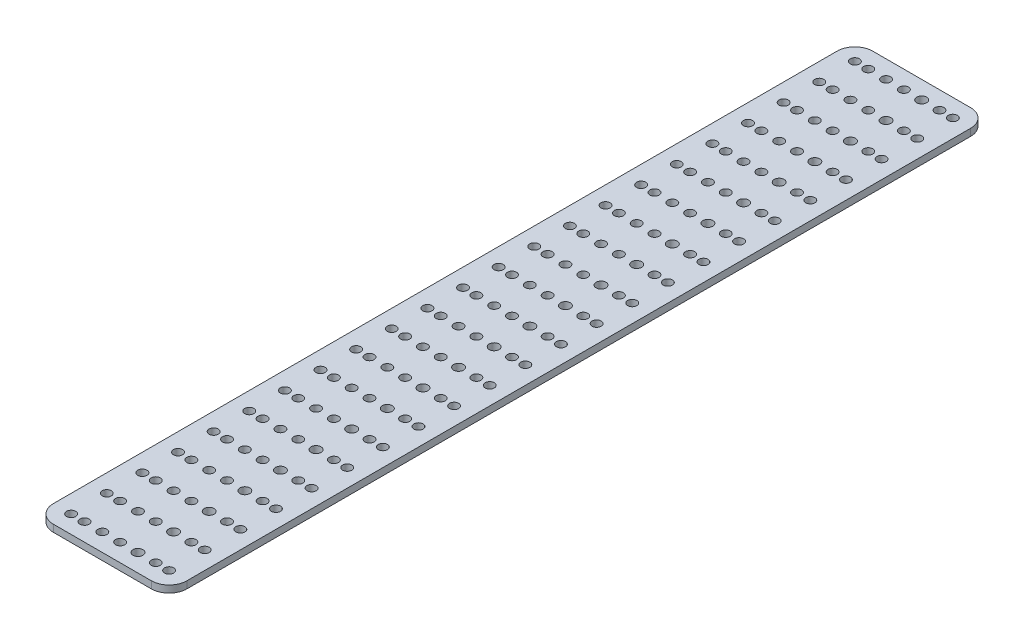
from build123d import *

# Parameters (mm, degrees)
SKETCH2_W           = 60
SKETCH2_H           = 368
SKETCH2_R           = 2.05
SKETCH2_R_2         = 2.218759553
BOSS_EXTRUDE2_DEPTH = 3.175
FILLET1_R           = 8


with BuildPart() as part:
    # Sketch2 → Boss-Extrude2 (new body)
    with BuildSketch(Plane(origin=(0, 0, 0), x_dir=(1, 0, 0), z_dir=(0, 1, 0))):
        Rectangle(SKETCH2_W, SKETCH2_H)
        with Locations(Location((-22, 176, 0), (0, 0, 270))):
            Circle(SKETCH2_R, mode=Mode.SUBTRACT)
        with Locations(Location((-16, 176, 0), (0, 0, 270))):
            Circle(SKETCH2_R, mode=Mode.SUBTRACT)
        with Locations(Location((0, 176, 0), (0, 0, 270))):
            Circle(SKETCH2_R, mode=Mode.SUBTRACT)
        with Locations(Location((16, 176, 0), (0, 0, 270))):
            Circle(SKETCH2_R, mode=Mode.SUBTRACT)
        with Locations(Location((22, 176, 0), (0, 0, 90))):
            Circle(SKETCH2_R, mode=Mode.SUBTRACT)
        with Locations(Location((-8, 176, 0), (0, 0, 270))):
            Circle(SKETCH2_R, mode=Mode.SUBTRACT)
        with Locations(Location((8, 176, 0), (0, 0, 270))):
            Circle(SKETCH2_R_2, mode=Mode.SUBTRACT)
        with Locations(Location((22, 160, 0), (0, 0, 90))):
            Circle(SKETCH2_R, mode=Mode.SUBTRACT)
        with Locations(Location((16, 160, 0), (0, 0, 270))):
            Circle(SKETCH2_R, mode=Mode.SUBTRACT)
        with Locations(Location((8, 160, 0), (0, 0, 270))):
            Circle(SKETCH2_R_2, mode=Mode.SUBTRACT)
        with Locations(Location((0, 160, 0), (0, 0, 270))):
            Circle(SKETCH2_R, mode=Mode.SUBTRACT)
        with Locations(Location((-8, 160, 0), (0, 0, 270))):
            Circle(SKETCH2_R, mode=Mode.SUBTRACT)
        with Locations(Location((-16, 160, 0), (0, 0, 270))):
            Circle(SKETCH2_R, mode=Mode.SUBTRACT)
        with Locations(Location((-22, 160, 0), (0, 0, 270))):
            Circle(SKETCH2_R, mode=Mode.SUBTRACT)
        with Locations(Location((22, 144, 0), (0, 0, 90))):
            Circle(SKETCH2_R, mode=Mode.SUBTRACT)
        with Locations(Location((16, 144, 0), (0, 0, 270))):
            Circle(SKETCH2_R, mode=Mode.SUBTRACT)
        with Locations(Location((8, 144, 0), (0, 0, 270))):
            Circle(SKETCH2_R_2, mode=Mode.SUBTRACT)
        with Locations(Location((0, 144, 0), (0, 0, 270))):
            Circle(SKETCH2_R, mode=Mode.SUBTRACT)
        with Locations(Location((-8, 144, 0), (0, 0, 270))):
            Circle(SKETCH2_R, mode=Mode.SUBTRACT)
        with Locations(Location((-16, 144, 0), (0, 0, 270))):
            Circle(SKETCH2_R, mode=Mode.SUBTRACT)
        with Locations(Location((-22, 144, 0), (0, 0, 270))):
            Circle(SKETCH2_R, mode=Mode.SUBTRACT)
        with Locations(Location((22, 128, 0), (0, 0, 90))):
            Circle(SKETCH2_R, mode=Mode.SUBTRACT)
        with Locations(Location((16, 128, 0), (0, 0, 270))):
            Circle(SKETCH2_R, mode=Mode.SUBTRACT)
        with Locations(Location((8, 128, 0), (0, 0, 270))):
            Circle(SKETCH2_R_2, mode=Mode.SUBTRACT)
        with Locations(Location((0, 128, 0), (0, 0, 270))):
            Circle(SKETCH2_R, mode=Mode.SUBTRACT)
        with Locations(Location((-8, 128, 0), (0, 0, 270))):
            Circle(SKETCH2_R, mode=Mode.SUBTRACT)
        with Locations(Location((-16, 128, 0), (0, 0, 270))):
            Circle(SKETCH2_R, mode=Mode.SUBTRACT)
        with Locations(Location((-22, 128, 0), (0, 0, 270))):
            Circle(SKETCH2_R, mode=Mode.SUBTRACT)
        with Locations(Location((22, 112, 0), (0, 0, 90))):
            Circle(SKETCH2_R, mode=Mode.SUBTRACT)
        with Locations(Location((16, 112, 0), (0, 0, 270))):
            Circle(SKETCH2_R, mode=Mode.SUBTRACT)
        with Locations(Location((8, 112, 0), (0, 0, 270))):
            Circle(SKETCH2_R_2, mode=Mode.SUBTRACT)
        with Locations(Location((0, 112, 0), (0, 0, 270))):
            Circle(SKETCH2_R, mode=Mode.SUBTRACT)
        with Locations(Location((-8, 112, 0), (0, 0, 270))):
            Circle(SKETCH2_R, mode=Mode.SUBTRACT)
        with Locations(Location((-16, 112, 0), (0, 0, 270))):
            Circle(SKETCH2_R, mode=Mode.SUBTRACT)
        with Locations(Location((-22, 112, 0), (0, 0, 270))):
            Circle(SKETCH2_R, mode=Mode.SUBTRACT)
        with Locations(Location((22, 96, 0), (0, 0, 90))):
            Circle(SKETCH2_R, mode=Mode.SUBTRACT)
        with Locations(Location((16, 96, 0), (0, 0, 270))):
            Circle(SKETCH2_R, mode=Mode.SUBTRACT)
        with Locations(Location((8, 96, 0), (0, 0, 270))):
            Circle(SKETCH2_R_2, mode=Mode.SUBTRACT)
        with Locations(Location((0, 96, 0), (0, 0, 270))):
            Circle(SKETCH2_R, mode=Mode.SUBTRACT)
        with Locations(Location((-8, 96, 0), (0, 0, 270))):
            Circle(SKETCH2_R, mode=Mode.SUBTRACT)
        with Locations(Location((-16, 96, 0), (0, 0, 270))):
            Circle(SKETCH2_R, mode=Mode.SUBTRACT)
        with Locations(Location((-22, 96, 0), (0, 0, 270))):
            Circle(SKETCH2_R, mode=Mode.SUBTRACT)
        with Locations(Location((22, 80, 0), (0, 0, 90))):
            Circle(SKETCH2_R, mode=Mode.SUBTRACT)
        with Locations(Location((16, 80, 0), (0, 0, 270))):
            Circle(SKETCH2_R, mode=Mode.SUBTRACT)
        with Locations(Location((8, 80, 0), (0, 0, 270))):
            Circle(SKETCH2_R_2, mode=Mode.SUBTRACT)
        with Locations(Location((0, 80, 0), (0, 0, 270))):
            Circle(SKETCH2_R, mode=Mode.SUBTRACT)
        with Locations(Location((-8, 80, 0), (0, 0, 270))):
            Circle(SKETCH2_R, mode=Mode.SUBTRACT)
        with Locations(Location((-16, 80, 0), (0, 0, 270))):
            Circle(SKETCH2_R, mode=Mode.SUBTRACT)
        with Locations(Location((-22, 80, 0), (0, 0, 270))):
            Circle(SKETCH2_R, mode=Mode.SUBTRACT)
        with Locations(Location((22, 64, 0), (0, 0, 90))):
            Circle(SKETCH2_R, mode=Mode.SUBTRACT)
        with Locations(Location((16, 64, 0), (0, 0, 270))):
            Circle(SKETCH2_R, mode=Mode.SUBTRACT)
        with Locations(Location((8, 64, 0), (0, 0, 270))):
            Circle(SKETCH2_R_2, mode=Mode.SUBTRACT)
        with Locations(Location((0, 64, 0), (0, 0, 270))):
            Circle(SKETCH2_R, mode=Mode.SUBTRACT)
        with Locations(Location((-8, 64, 0), (0, 0, 270))):
            Circle(SKETCH2_R, mode=Mode.SUBTRACT)
        with Locations(Location((-16, 64, 0), (0, 0, 270))):
            Circle(SKETCH2_R, mode=Mode.SUBTRACT)
        with Locations(Location((-22, 64, 0), (0, 0, 270))):
            Circle(SKETCH2_R, mode=Mode.SUBTRACT)
        with Locations(Location((22, 48, 0), (0, 0, 90))):
            Circle(SKETCH2_R, mode=Mode.SUBTRACT)
        with Locations(Location((16, 48, 0), (0, 0, 270))):
            Circle(SKETCH2_R, mode=Mode.SUBTRACT)
        with Locations(Location((8, 48, 0), (0, 0, 270))):
            Circle(SKETCH2_R_2, mode=Mode.SUBTRACT)
        with Locations(Location((0, 48, 0), (0, 0, 270))):
            Circle(SKETCH2_R, mode=Mode.SUBTRACT)
        with Locations(Location((-8, 48, 0), (0, 0, 270))):
            Circle(SKETCH2_R, mode=Mode.SUBTRACT)
        with Locations(Location((-16, 48, 0), (0, 0, 270))):
            Circle(SKETCH2_R, mode=Mode.SUBTRACT)
        with Locations(Location((-22, 48, 0), (0, 0, 270))):
            Circle(SKETCH2_R, mode=Mode.SUBTRACT)
        with Locations(Location((22, 32, 0), (0, 0, 90))):
            Circle(SKETCH2_R, mode=Mode.SUBTRACT)
        with Locations(Location((16, 32, 0), (0, 0, 270))):
            Circle(SKETCH2_R, mode=Mode.SUBTRACT)
        with Locations(Location((8, 32, 0), (0, 0, 270))):
            Circle(SKETCH2_R_2, mode=Mode.SUBTRACT)
        with Locations(Location((0, 32, 0), (0, 0, 270))):
            Circle(SKETCH2_R, mode=Mode.SUBTRACT)
        with Locations(Location((-8, 32, 0), (0, 0, 270))):
            Circle(SKETCH2_R, mode=Mode.SUBTRACT)
        with Locations(Location((-16, 32, 0), (0, 0, 270))):
            Circle(SKETCH2_R, mode=Mode.SUBTRACT)
        with Locations(Location((-22, 32, 0), (0, 0, 270))):
            Circle(SKETCH2_R, mode=Mode.SUBTRACT)
        with Locations(Location((22, 16, 0), (0, 0, 90))):
            Circle(SKETCH2_R, mode=Mode.SUBTRACT)
        with Locations(Location((16, 16, 0), (0, 0, 270))):
            Circle(SKETCH2_R, mode=Mode.SUBTRACT)
        with Locations(Location((8, 16, 0), (0, 0, 270))):
            Circle(SKETCH2_R_2, mode=Mode.SUBTRACT)
        with Locations(Location((0, 16, 0), (0, 0, 270))):
            Circle(SKETCH2_R, mode=Mode.SUBTRACT)
        with Locations(Location((-8, 16, 0), (0, 0, 270))):
            Circle(SKETCH2_R, mode=Mode.SUBTRACT)
        with Locations(Location((-16, 16, 0), (0, 0, 270))):
            Circle(SKETCH2_R, mode=Mode.SUBTRACT)
        with Locations(Location((-22, 16, 0), (0, 0, 270))):
            Circle(SKETCH2_R, mode=Mode.SUBTRACT)
        with Locations(Location((22, 0, 0), (0, 0, 90))):
            Circle(SKETCH2_R, mode=Mode.SUBTRACT)
        with Locations(Location((16, 0, 0), (0, 0, 270))):
            Circle(SKETCH2_R, mode=Mode.SUBTRACT)
        with Locations(Location((8, 0, 0), (0, 0, 270))):
            Circle(SKETCH2_R_2, mode=Mode.SUBTRACT)
        with Locations(Location((0, 0, 0), (0, 0, 270))):
            Circle(SKETCH2_R, mode=Mode.SUBTRACT)
        with Locations(Location((-8, 0, 0), (0, 0, 270))):
            Circle(SKETCH2_R, mode=Mode.SUBTRACT)
        with Locations(Location((-16, 0, 0), (0, 0, 270))):
            Circle(SKETCH2_R, mode=Mode.SUBTRACT)
        with Locations(Location((-22, 0, 0), (0, 0, 270))):
            Circle(SKETCH2_R, mode=Mode.SUBTRACT)
        with Locations(Location((22, -16, 0), (0, 0, 90))):
            Circle(SKETCH2_R, mode=Mode.SUBTRACT)
        with Locations(Location((16, -16, 0), (0, 0, 270))):
            Circle(SKETCH2_R, mode=Mode.SUBTRACT)
        with Locations(Location((8, -16, 0), (0, 0, 270))):
            Circle(SKETCH2_R_2, mode=Mode.SUBTRACT)
        with Locations(Location((0, -16, 0), (0, 0, 270))):
            Circle(SKETCH2_R, mode=Mode.SUBTRACT)
        with Locations(Location((-8, -16, 0), (0, 0, 270))):
            Circle(SKETCH2_R, mode=Mode.SUBTRACT)
        with Locations(Location((-16, -16, 0), (0, 0, 270))):
            Circle(SKETCH2_R, mode=Mode.SUBTRACT)
        with Locations(Location((-22, -16, 0), (0, 0, 270))):
            Circle(SKETCH2_R, mode=Mode.SUBTRACT)
        with Locations(Location((22, -32, 0), (0, 0, 90))):
            Circle(SKETCH2_R, mode=Mode.SUBTRACT)
        with Locations(Location((16, -32, 0), (0, 0, 270))):
            Circle(SKETCH2_R, mode=Mode.SUBTRACT)
        with Locations(Location((8, -32, 0), (0, 0, 270))):
            Circle(SKETCH2_R_2, mode=Mode.SUBTRACT)
        with Locations(Location((0, -32, 0), (0, 0, 270))):
            Circle(SKETCH2_R, mode=Mode.SUBTRACT)
        with Locations(Location((-8, -32, 0), (0, 0, 270))):
            Circle(SKETCH2_R, mode=Mode.SUBTRACT)
        with Locations(Location((-16, -32, 0), (0, 0, 270))):
            Circle(SKETCH2_R, mode=Mode.SUBTRACT)
        with Locations(Location((-22, -32, 0), (0, 0, 270))):
            Circle(SKETCH2_R, mode=Mode.SUBTRACT)
        with Locations(Location((22, -48, 0), (0, 0, 90))):
            Circle(SKETCH2_R, mode=Mode.SUBTRACT)
        with Locations(Location((16, -48, 0), (0, 0, 270))):
            Circle(SKETCH2_R, mode=Mode.SUBTRACT)
        with Locations(Location((8, -48, 0), (0, 0, 270))):
            Circle(SKETCH2_R_2, mode=Mode.SUBTRACT)
        with Locations(Location((0, -48, 0), (0, 0, 270))):
            Circle(SKETCH2_R, mode=Mode.SUBTRACT)
        with Locations(Location((-8, -48, 0), (0, 0, 270))):
            Circle(SKETCH2_R, mode=Mode.SUBTRACT)
        with Locations(Location((-16, -48, 0), (0, 0, 270))):
            Circle(SKETCH2_R, mode=Mode.SUBTRACT)
        with Locations(Location((-22, -48, 0), (0, 0, 270))):
            Circle(SKETCH2_R, mode=Mode.SUBTRACT)
        with Locations(Location((22, -64, 0), (0, 0, 90))):
            Circle(SKETCH2_R, mode=Mode.SUBTRACT)
        with Locations(Location((16, -64, 0), (0, 0, 270))):
            Circle(SKETCH2_R, mode=Mode.SUBTRACT)
        with Locations(Location((8, -64, 0), (0, 0, 270))):
            Circle(SKETCH2_R_2, mode=Mode.SUBTRACT)
        with Locations(Location((0, -64, 0), (0, 0, 270))):
            Circle(SKETCH2_R, mode=Mode.SUBTRACT)
        with Locations(Location((-8, -64, 0), (0, 0, 270))):
            Circle(SKETCH2_R, mode=Mode.SUBTRACT)
        with Locations(Location((-16, -64, 0), (0, 0, 270))):
            Circle(SKETCH2_R, mode=Mode.SUBTRACT)
        with Locations(Location((-22, -64, 0), (0, 0, 270))):
            Circle(SKETCH2_R, mode=Mode.SUBTRACT)
        with Locations(Location((22, -80, 0), (0, 0, 90))):
            Circle(SKETCH2_R, mode=Mode.SUBTRACT)
        with Locations(Location((16, -80, 0), (0, 0, 270))):
            Circle(SKETCH2_R, mode=Mode.SUBTRACT)
        with Locations(Location((8, -80, 0), (0, 0, 270))):
            Circle(SKETCH2_R_2, mode=Mode.SUBTRACT)
        with Locations(Location((0, -80, 0), (0, 0, 270))):
            Circle(SKETCH2_R, mode=Mode.SUBTRACT)
        with Locations(Location((-8, -80, 0), (0, 0, 270))):
            Circle(SKETCH2_R, mode=Mode.SUBTRACT)
        with Locations(Location((-16, -80, 0), (0, 0, 270))):
            Circle(SKETCH2_R, mode=Mode.SUBTRACT)
        with Locations(Location((-22, -80, 0), (0, 0, 270))):
            Circle(SKETCH2_R, mode=Mode.SUBTRACT)
        with Locations(Location((22, -96, 0), (0, 0, 90))):
            Circle(SKETCH2_R, mode=Mode.SUBTRACT)
        with Locations(Location((16, -96, 0), (0, 0, 270))):
            Circle(SKETCH2_R, mode=Mode.SUBTRACT)
        with Locations(Location((8, -96, 0), (0, 0, 270))):
            Circle(SKETCH2_R_2, mode=Mode.SUBTRACT)
        with Locations(Location((0, -96, 0), (0, 0, 270))):
            Circle(SKETCH2_R, mode=Mode.SUBTRACT)
        with Locations(Location((-8, -96, 0), (0, 0, 270))):
            Circle(SKETCH2_R, mode=Mode.SUBTRACT)
        with Locations(Location((-16, -96, 0), (0, 0, 270))):
            Circle(SKETCH2_R, mode=Mode.SUBTRACT)
        with Locations(Location((-22, -96, 0), (0, 0, 270))):
            Circle(SKETCH2_R, mode=Mode.SUBTRACT)
        with Locations(Location((22, -112, 0), (0, 0, 90))):
            Circle(SKETCH2_R, mode=Mode.SUBTRACT)
        with Locations(Location((16, -112, 0), (0, 0, 270))):
            Circle(SKETCH2_R, mode=Mode.SUBTRACT)
        with Locations(Location((8, -112, 0), (0, 0, 270))):
            Circle(SKETCH2_R_2, mode=Mode.SUBTRACT)
        with Locations(Location((0, -112, 0), (0, 0, 270))):
            Circle(SKETCH2_R, mode=Mode.SUBTRACT)
        with Locations(Location((-8, -112, 0), (0, 0, 270))):
            Circle(SKETCH2_R, mode=Mode.SUBTRACT)
        with Locations(Location((-16, -112, 0), (0, 0, 270))):
            Circle(SKETCH2_R, mode=Mode.SUBTRACT)
        with Locations(Location((-22, -112, 0), (0, 0, 270))):
            Circle(SKETCH2_R, mode=Mode.SUBTRACT)
        with Locations(Location((22, -128, 0), (0, 0, 90))):
            Circle(SKETCH2_R, mode=Mode.SUBTRACT)
        with Locations(Location((16, -128, 0), (0, 0, 270))):
            Circle(SKETCH2_R, mode=Mode.SUBTRACT)
        with Locations(Location((8, -128, 0), (0, 0, 270))):
            Circle(SKETCH2_R_2, mode=Mode.SUBTRACT)
        with Locations(Location((0, -128, 0), (0, 0, 270))):
            Circle(SKETCH2_R, mode=Mode.SUBTRACT)
        with Locations(Location((-8, -128, 0), (0, 0, 270))):
            Circle(SKETCH2_R, mode=Mode.SUBTRACT)
        with Locations(Location((-16, -128, 0), (0, 0, 270))):
            Circle(SKETCH2_R, mode=Mode.SUBTRACT)
        with Locations(Location((-22, -128, 0), (0, 0, 270))):
            Circle(SKETCH2_R, mode=Mode.SUBTRACT)
        with Locations(Location((22, -144, 0), (0, 0, 90))):
            Circle(SKETCH2_R, mode=Mode.SUBTRACT)
        with Locations(Location((16, -144, 0), (0, 0, 270))):
            Circle(SKETCH2_R, mode=Mode.SUBTRACT)
        with Locations(Location((8, -144, 0), (0, 0, 270))):
            Circle(SKETCH2_R_2, mode=Mode.SUBTRACT)
        with Locations(Location((0, -144, 0), (0, 0, 270))):
            Circle(SKETCH2_R, mode=Mode.SUBTRACT)
        with Locations(Location((-8, -144, 0), (0, 0, 270))):
            Circle(SKETCH2_R, mode=Mode.SUBTRACT)
        with Locations(Location((-16, -144, 0), (0, 0, 270))):
            Circle(SKETCH2_R, mode=Mode.SUBTRACT)
        with Locations(Location((-22, -144, 0), (0, 0, 270))):
            Circle(SKETCH2_R, mode=Mode.SUBTRACT)
        with Locations(Location((22, -160, 0), (0, 0, 90))):
            Circle(SKETCH2_R, mode=Mode.SUBTRACT)
        with Locations(Location((16, -160, 0), (0, 0, 270))):
            Circle(SKETCH2_R, mode=Mode.SUBTRACT)
        with Locations(Location((8, -160, 0), (0, 0, 270))):
            Circle(SKETCH2_R_2, mode=Mode.SUBTRACT)
        with Locations(Location((0, -160, 0), (0, 0, 270))):
            Circle(SKETCH2_R, mode=Mode.SUBTRACT)
        with Locations(Location((-8, -160, 0), (0, 0, 270))):
            Circle(SKETCH2_R, mode=Mode.SUBTRACT)
        with Locations(Location((-16, -160, 0), (0, 0, 270))):
            Circle(SKETCH2_R, mode=Mode.SUBTRACT)
        with Locations(Location((-22, -160, 0), (0, 0, 270))):
            Circle(SKETCH2_R, mode=Mode.SUBTRACT)
        with Locations(Location((22, -176, 0), (0, 0, 90))):
            Circle(SKETCH2_R, mode=Mode.SUBTRACT)
        with Locations(Location((16, -176, 0), (0, 0, 270))):
            Circle(SKETCH2_R, mode=Mode.SUBTRACT)
        with Locations(Location((8, -176, 0), (0, 0, 270))):
            Circle(SKETCH2_R_2, mode=Mode.SUBTRACT)
        with Locations(Location((0, -176, 0), (0, 0, 270))):
            Circle(SKETCH2_R, mode=Mode.SUBTRACT)
        with Locations(Location((-8, -176, 0), (0, 0, 270))):
            Circle(SKETCH2_R, mode=Mode.SUBTRACT)
        with Locations(Location((-16, -176, 0), (0, 0, 270))):
            Circle(SKETCH2_R, mode=Mode.SUBTRACT)
        with Locations(Location((-22, -176, 0), (0, 0, 270))):
            Circle(SKETCH2_R, mode=Mode.SUBTRACT)
    extrude(amount=BOSS_EXTRUDE2_DEPTH)

    # Fillet1
    fillet1_edges = [part.edges().sort_by_distance(p)[0] for p in [
        (30, 1.5875, 184),
        (-30, 1.5875, 184),
        (-30, 1.5875, -184),
        (30, 1.5875, -184),
    ]]
    fillet(fillet1_edges, radius=FILLET1_R)


solid = part.part
